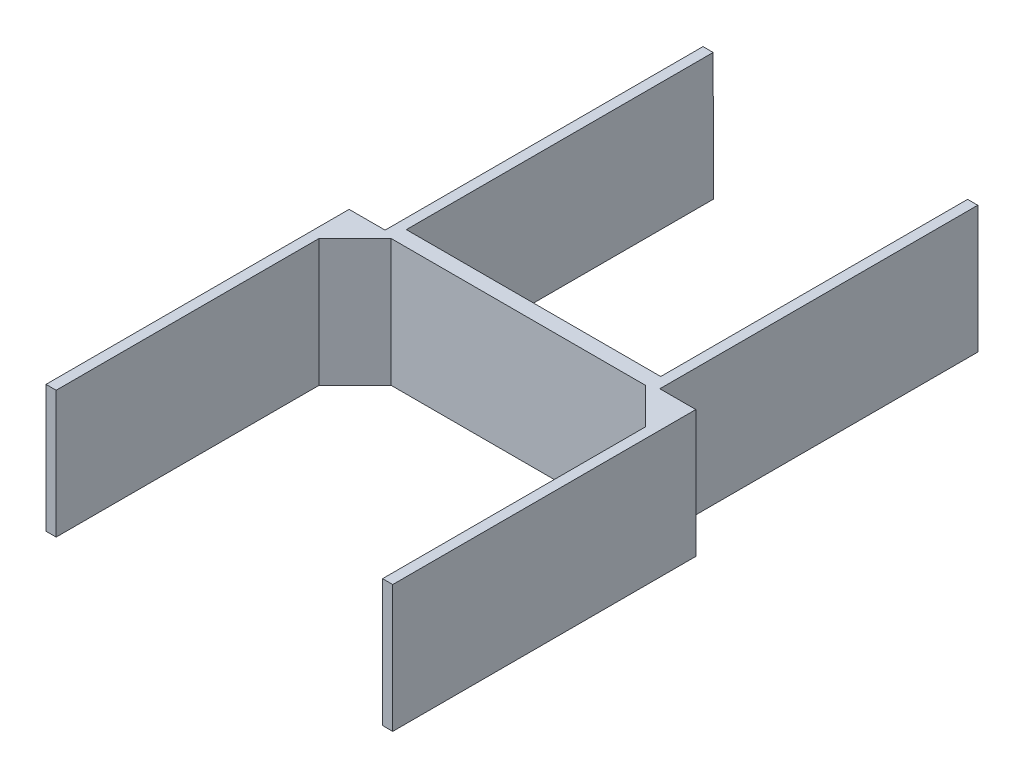
from build123d import *

# Parameters (mm, degrees)
BOSS_EXTRU_1_DEPTH = 25
BOSS_EXTRU_2_DEPTH = 2
BOSS_EXTRU_3_DEPTH = 2
BOSS_EXTRU_5_DEPTH = 2
ESQUISSE4_W        = 12.5
ESQUISSE4_H        = 25
BOSS_EXTRU_6_DEPTH = 2


with BuildPart() as part:
    # Esquisse1 → Boss.-Extru.1 (new body)
    with BuildSketch(Plane(origin=(0, 0, 0), x_dir=(1, 0, 0), z_dir=(0, 1, 0))):
        Polygon((-34.071067812, -19.102794325), (-34.071067812, -12.031726513), (-27, -12.031726513), (-27, 37.968273487), (-25, 37.968273487), (-25, -9.860153638), (25, -9.860153638), (25, 37.968273487), (27, 37.968273487), (27, -12.031726513), (34.071067812, -12.031726513), (34.071067812, -19.102794325), (34.071067812, -59.102794325), (32.071067812, -59.102794325), (32.071067812, -19.93122145), (25, -12.860153638), (-25, -12.860153638), (-32.071067812, -19.93122145), (-32.071067812, -59.102794325), (-34.071067812, -59.102794325), align=None)
    extrude(amount=BOSS_EXTRU_1_DEPTH)

    # Esquisse2 → Boss.-Extru.2 (add)
    with BuildSketch(Plane(origin=(34.071067812, 0, 0), x_dir=(0, 0, -1), z_dir=(1, 0, 0))):
        Polygon((-59.102794325, 25), (-71.602794325, 25), (-71.602794325, 0), (-59.102794325, 0), (-12.031726513, 0), (-12.031726513, 25), align=None)
    extrude(amount=-BOSS_EXTRU_2_DEPTH)

    # Esquisse3 → Boss.-Extru.3 (add)
    with BuildSketch(Plane(origin=(27, 0, 0), x_dir=(0, 0, -1), z_dir=(1, 0, 0))):
        Polygon((37.947300388, 25), (50.447300388, 25), (50.491690046, 0), (37.947300388, 0), align=None)
    extrude(amount=-BOSS_EXTRU_3_DEPTH)

    # Esquisse5 → Boss.-Extru.5 (add)
    with BuildSketch(Plane.ZY.offset(27)):
        Polygon((-37.968273487, 0), (-37.968273487, 25), (-50.447300388, 25), (-50.491690046, 0), align=None)
    extrude(amount=-BOSS_EXTRU_5_DEPTH)

    # Esquisse4 → Boss.-Extru.6 (add)
    with BuildSketch(Plane.ZY.offset(34.071067812)):
        with Locations((65.352794325, 12.5)):
            Rectangle(ESQUISSE4_W, ESQUISSE4_H)
    extrude(amount=-BOSS_EXTRU_6_DEPTH)


solid = part.part
